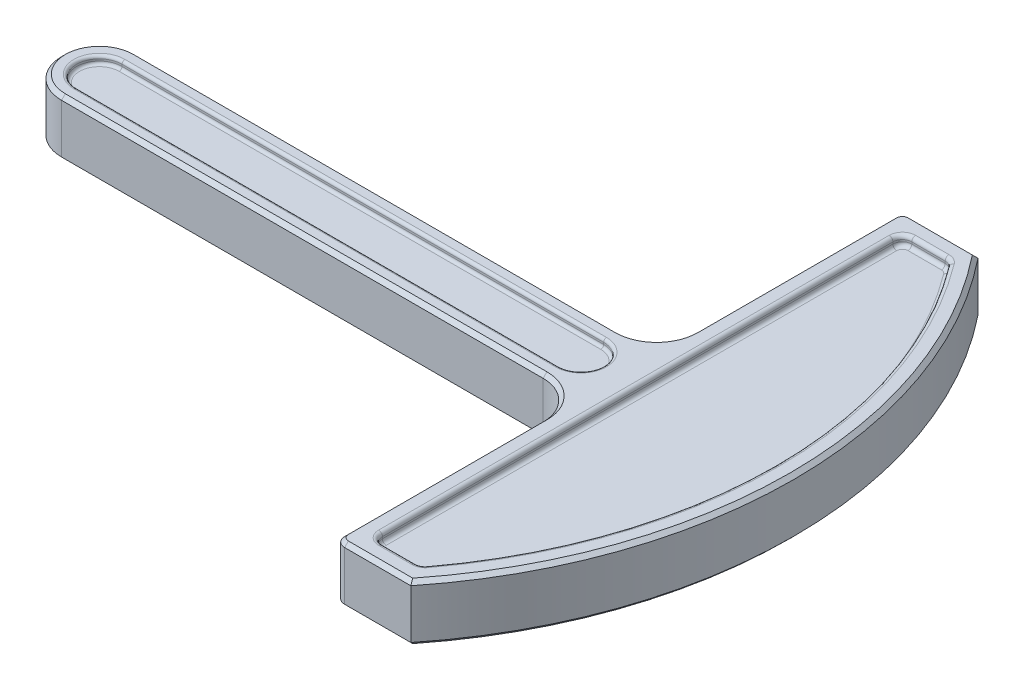
from build123d import *

# Parameters (mm, degrees)
SKETCH1_W           = 147.349939952
SKETCH1_H           = 20
BOSS_EXTRUDE1_DEPTH = 7.5
FILLET1_R           = 10
FILLET2_RADIUS      = 10
FILLET2_LENGTH      = 15
FILLET3_R           = 2.5
CHAMFER1_SIZE       = 1
CHAMFER2_SIZE       = 1
CUT_EXTRUDE1_DEPTH  = 2.5
FILLET4_R           = 2.5
FILLET5_R           = 1
CUT_EXTRUDE2_DEPTH  = 2
FILLET6_R           = 0.75


with BuildPart() as part:
    # Sketch1 → Boss-Extrude1 (new, symmetric)
    with BuildSketch(Plane(origin=(0, 0, 0), x_dir=(1, 0, 0), z_dir=(0, 1, 0))):
        with BuildLine():
            ThreePointArc((167.349939952, 75), (193.674969976, 0), (167.349939952, -75))
            Line((167.349939952, -75), (147.349939952, -75))
            Line((147.349939952, -75), (147.349939952, 75))
            Line((147.349939952, 75), (167.349939952, 75))
        make_face()
        with Locations((73.674969976, 0)):
            Rectangle(SKETCH1_W, SKETCH1_H)
    extrude(amount=BOSS_EXTRUDE1_DEPTH, both=True)

    # Fillet1
    fillet1_edges = [part.edges().sort_by_distance(p)[0] for p in [
        (147.349939952, 0, 10),
        (147.349939952, 0, -10),
    ]]
    fillet(fillet1_edges, radius=FILLET1_R)

    # Fillet2: full round fillet: the end face becomes a half cylinder, R = half its width
    fillet2_face = Plane((0, 0, 0), x_dir=(0, 1, 0), z_dir=(-1, 0, 0))  # on the end face: x along it, z out of the body
    fillet2_slab = fillet2_face.offset(-FILLET2_RADIUS / 2) * Box(FILLET2_LENGTH, 2 * FILLET2_RADIUS, FILLET2_RADIUS, mode=Mode.PRIVATE)  # the body's end, R deep
    fillet2_round = Plane((10, 0, 0), x_dir=(-1, 0, 0), z_dir=(0, 1, 0)) * Cylinder(FILLET2_RADIUS, FILLET2_LENGTH, mode=Mode.PRIVATE)  # its axis R under the face
    add(fillet2_slab - fillet2_round, mode=Mode.SUBTRACT)

    # Fillet3
    fillet3_edges = [part.edges().sort_by_distance(p)[0] for p in [
        (147.349939952, 0, 75),
        (147.349939952, 0, -75),
    ]]
    fillet(fillet3_edges, radius=FILLET3_R)

    # Chamfer1
    chamfer1_edges = [part.edges().sort_by_distance(p)[0] for p in [
        (158.599939952, 7.5, -75),
        (158.599939952, -7.5, -75),
        (73.674969976, -7.5, -10),
        (73.674969976, 7.5, -10),
        (147.349939952, -7.5, 46.25),
        (147.349939952, 7.5, 46.25),
        (73.674969976, -7.5, 10),
        (73.674969976, 7.5, 10),
        (144.421007764, -7.5, -12.928932188),
        (144.421007764, 7.5, -12.928932188),
        (144.421007764, -7.5, 12.928932188),
        (144.421007764, 7.5, 12.928932188),
        (158.599939952, 7.5, 75),
        (0, 7.5, 0),
        (0, -7.5, 0),
        (147.349939952, -7.5, -46.25),
        (147.349939952, 7.5, -46.25),
        (148.082172999, -7.5, 74.267766953),
        (148.082172999, -7.5, -74.267766953),
        (148.082172999, 7.5, 74.267766953),
        (148.082172999, 7.5, -74.267766953),
        (158.599939952, -7.5, 75),
    ]]
    chamfer(chamfer1_edges, length=CHAMFER1_SIZE)

    # Chamfer2
    chamfer2_edges = [part.edges().sort_by_distance(p)[0] for p in [
        (193.674969976, -7.5, 0),
        (193.674969976, 7.5, 0),
    ]]
    chamfer(chamfer2_edges, length=CHAMFER2_SIZE)

    # Sketch2 → Cut-Extrude1 (cut)
    with BuildSketch(Plane(origin=(0, 7.5, 0), x_dir=(1, 0, 0), z_dir=(0, 1, 0))):
        with BuildLine():
            Line((164.91640793, -70), (152.349939952, -70))
            Line((152.349939952, -70), (152.349939952, -20))
            Line((152.349939952, -20), (152.349939952, 70))
            Line((152.349939952, 70), (164.91640793, 70))
            ThreePointArc((164.91640793, 70), (188.674969976, 0), (164.91640793, -70))
        make_face()
    cut_extrude1 = extrude(amount=-CUT_EXTRUDE1_DEPTH, mode=Mode.SUBTRACT)

    # Mirror1: Cut-Extrude1 across plane
    add(cut_extrude1.mirror(Plane.ZX), mode=Mode.SUBTRACT)

    # Fillet4
    fillet4_edges = [part.edges().sort_by_distance(p)[0] for p in [
        (164.91640793, 6.25, 70),
        (152.349939952, 6.25, 70),
        (152.349939952, 6.25, -70),
        (164.91640793, 6.25, -70),
        (152.349939952, -6.25, 70),
        (164.91640793, -6.25, 70),
        (164.91640793, -6.25, -70),
        (152.349939952, -6.25, -70),
    ]]
    fillet(fillet4_edges, radius=FILLET4_R)

    # Fillet5
    fillet5_edges = [part.edges().sort_by_distance(p)[0] for p in [
        (188.674969976, -7.5, 0),
        (188.674969976, -5, 0),
        (159.262454964, -7.5, -70),
        (159.262454964, -5, -70),
        (159.262454964, -5, 70),
        (152.349939952, -5, 0),
        (153.082172999, -5, 69.267766953),
        (164.793003965, -5, 69.736067977),
        (153.082172999, -5, -69.267766953),
        (164.793003965, -5, -69.736067977),
        (152.349939952, -7.5, 0),
        (159.262454964, -7.5, 70),
        (188.674969976, 7.5, 0),
        (188.674969976, 5, 0),
        (159.262454964, 7.5, 70),
        (159.262454964, 5, 70),
        (159.262454964, 5, -70),
        (152.349939952, 5, 0),
        (153.082172999, 5, -69.267766953),
        (164.793003965, 5, -69.736067977),
        (153.082172999, 5, 69.267766953),
        (164.793003965, 5, 69.736067977),
        (152.349939952, 7.5, 0),
        (159.262454964, 7.5, -70),
        (164.793003965, -7.5, -69.736067977),
        (153.082172999, -7.5, -69.267766953),
        (164.793003965, -7.5, 69.736067977),
        (153.082172999, -7.5, 69.267766953),
        (164.793003965, 7.5, 69.736067977),
        (153.082172999, 7.5, 69.267766953),
        (164.793003965, 7.5, -69.736067977),
        (153.082172999, 7.5, -69.267766953),
    ]]
    fillet(fillet5_edges, radius=FILLET5_R)

    # Sketch3 → Cut-Extrude2 (cut)
    with BuildSketch(Plane(origin=(0, 7.5, 0), x_dir=(1, 0, 0), z_dir=(0, 1, 0))):
        with BuildLine():
            Line((10, 6), (137.349939952, 6))
            ThreePointArc((137.349939952, 6), (143.349939952, 0), (137.349939952, -6))
            Line((137.349939952, -6), (10, -6))
            ThreePointArc((10, -6), (4, 0), (10, 6))
        make_face()
    cut_extrude2 = extrude(amount=-CUT_EXTRUDE2_DEPTH, mode=Mode.SUBTRACT)

    # Mirror2: Cut-Extrude2 across plane
    add(cut_extrude2.mirror(Plane.ZX), mode=Mode.SUBTRACT)

    # Fillet6
    fillet6_edges = [part.edges().sort_by_distance(p)[0] for p in [
        (4, 5.5, 0),
        (73.674969976, 5.5, -6),
        (143.349939952, 5.5, 0),
        (73.674969976, 5.5, 6),
        (4, 7.5, 0),
        (73.674969976, 7.5, 6),
        (143.349939952, 7.5, 0),
        (73.674969976, 7.5, -6),
        (4, -7.5, 0),
        (73.674969976, -7.5, 6),
        (143.349939952, -7.5, 0),
        (73.674969976, -7.5, -6),
        (4, -5.5, 0),
        (73.674969976, -5.5, 6),
        (143.349939952, -5.5, 0),
        (73.674969976, -5.5, -6),
    ]]
    fillet(fillet6_edges, radius=FILLET6_R)


solid = part.part
